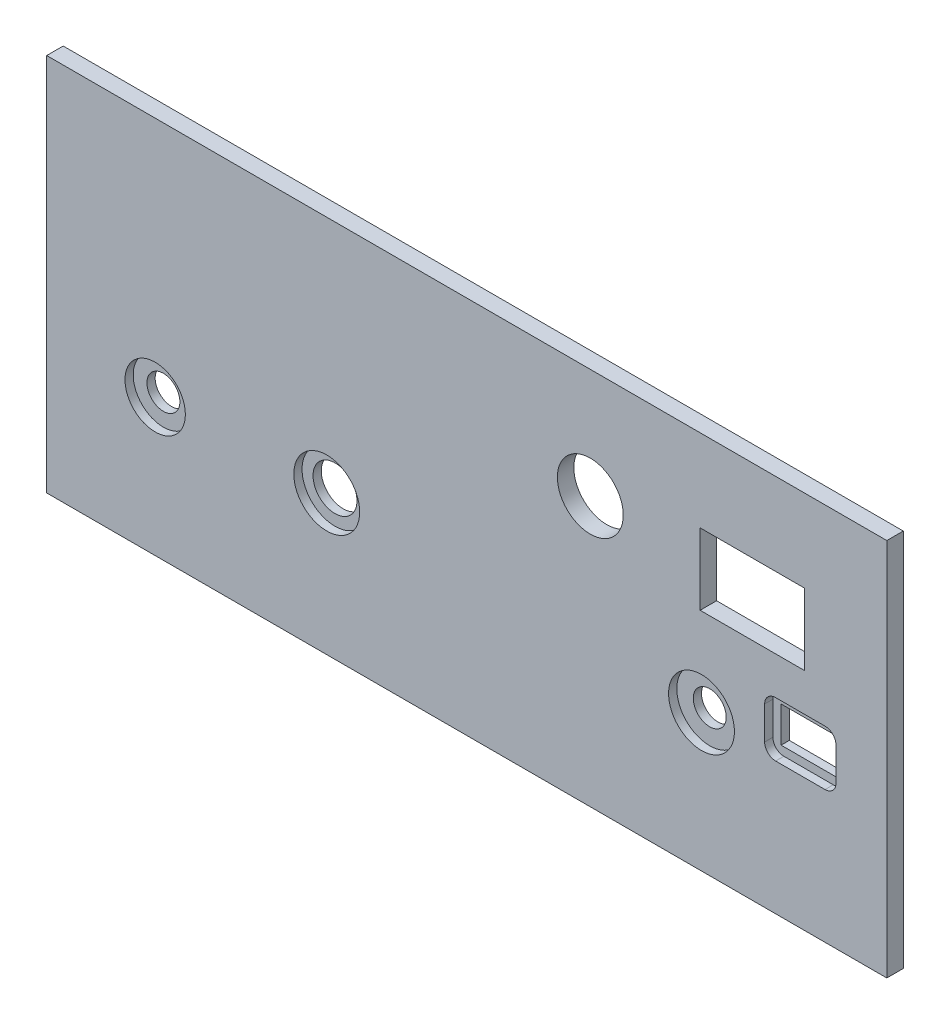
from build123d import *

# Parameters (mm, degrees)
IZIM1_W                     = 153
IZIM1_H                     = 69
Y_KSEKLIK_EKSTR_ZYON1_DEPTH = 3
IZIM2_R                     = 3
IZIM2_R_2                   = 4
IZIM2_R_3                   = 6
IZIM2_W                     = 19
IZIM2_H                     = 13
KES_EKSTR_ZYON1_DEPTH       = 3
IZIM4_R                     = 5.5
IZIM4_R_2                   = 6
KES_EKSTR_ZYON2_DEPTH       = 1.5
IZIM5_W                     = 13
IZIM5_H                     = 10
KES_EKSTR_ZYON4_DEPTH       = 1.5
IZIM7_W                     = 10
IZIM7_H                     = 6.5
KES_EKSTR_ZYON5_DEPTH       = 1.5
RADYUS1_R                   = 2


with BuildPart() as part:
    # Çizim1 → Yükseklik-Ekstrüzyon1 (new body)
    with BuildSketch(Plane.XY):
        with Locations((-76.5, 34.5)):
            Rectangle(IZIM1_W, IZIM1_H)
    extrude(amount=Y_KSEKLIK_EKSTR_ZYON1_DEPTH)

    # Çizim2 → Kes-Ekstrüzyon1 (cut)
    with BuildSketch(Plane.XY.offset(3)):
        with Locations((-133.25, 25)):
            Circle(IZIM2_R)
        with Locations((-102, 25.5)):
            Circle(IZIM2_R_2)
        with Locations((-33.75, 25)):
            Circle(IZIM2_R)
        with Locations((-54, 49)):
            Circle(IZIM2_R_3)
        with Locations((-24.5, 47.5)):
            Rectangle(IZIM2_W, IZIM2_H)
    extrude(amount=-KES_EKSTR_ZYON1_DEPTH, mode=Mode.SUBTRACT)

    # Çizim4 → Kes-Ekstrüzyon2 (cut)
    with BuildSketch(Plane.XY.offset(3)):
        with Locations((-133.25, 25)):
            Circle(IZIM4_R)
        with Locations((-102, 25.5)):
            Circle(IZIM4_R_2)
        with Locations((-33.75, 25)):
            Circle(IZIM4_R_2)
    extrude(amount=-KES_EKSTR_ZYON2_DEPTH, mode=Mode.SUBTRACT)

    # Çizim5 → Kes-Ekstrüzyon4 (cut)
    with BuildSketch(Plane.XY.offset(3)):
        with Locations((-15.75, 29.1)):
            Rectangle(IZIM5_W, IZIM5_H)
    extrude(amount=-KES_EKSTR_ZYON4_DEPTH, mode=Mode.SUBTRACT)

    # Çizim7 → Kes-Ekstrüzyon5 (cut)
    with BuildSketch(Plane.XY.offset(1.5)):
        with Locations((-15.75, 28.85)):
            Rectangle(IZIM7_W, IZIM7_H)
    extrude(amount=-KES_EKSTR_ZYON5_DEPTH, mode=Mode.SUBTRACT)

    # Radyus1
    radyus1_edges = [part.edges().sort_by_distance(p)[0] for p in [
        (-22.25, 24.1, 2.25),
        (-22.25, 34.1, 2.25),
        (-9.25, 34.1, 2.25),
        (-9.25, 24.1, 2.25),
    ]]
    fillet(radyus1_edges, radius=RADYUS1_R)


solid = part.part
